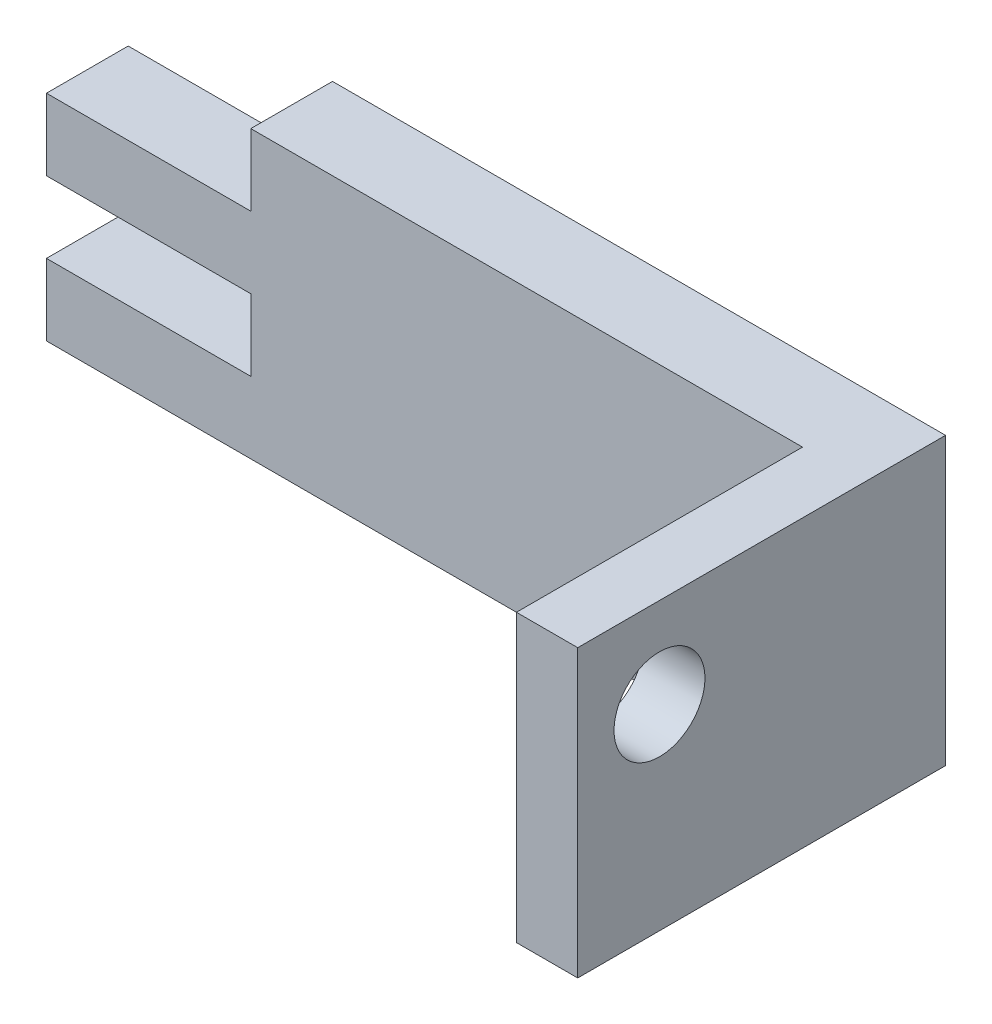
from build123d import *

# Parameters (mm, degrees)
CROQUIS1_W              = 350
CROQUIS1_H              = 90
SALIENTE_EXTRUIR1_DEPTH = 70
CROQUIS2_W              = 320
CROQUIS2_H              = 70
CORTAR_EXTRUIR1_DEPTH   = 194.778223751
CROQUIS3_R              = 11.125
CORTAR_EXTRUIR2_DEPTH   = 360.756862339
CROQUIS8_R              = 11.075
CORTAR_EXTRUIR3_DEPTH   = 209.865985742
CROQUIS9_R              = 11.075
CORTAR_EXTRUIR5_DEPTH   = 209.865985742


with BuildPart() as part:
    # Croquis1 → Saliente-Extruir1 (new body)
    with BuildSketch(Plane(origin=(0, 0, 0), x_dir=(1, 0, 0), z_dir=(0, 1, 0))):
        Rectangle(CROQUIS1_W, CROQUIS1_H)
    extrude(amount=SALIENTE_EXTRUIR1_DEPTH)

    # Croquis2 → Cortar-Extruir1 (cut, through all)
    with BuildSketch(Plane(origin=(0, 70, 0), x_dir=(1, 0, 0), z_dir=(0, 1, 0))):
        with Locations((0, -10)):
            Rectangle(CROQUIS2_W, CROQUIS2_H)
    extrude(amount=-CORTAR_EXTRUIR1_DEPTH, mode=Mode.SUBTRACT)

    # Croquis3 → Cortar-Extruir2 (cut, through all)
    with BuildSketch(Plane.ZY.offset(175)):
        with Locations((25, 48)):
            Circle(CROQUIS3_R)
    extrude(amount=-CORTAR_EXTRUIR2_DEPTH, mode=Mode.SUBTRACT)

    # Croquis8 → Cortar-Extruir3 (cut, through all)
    with BuildSketch(Plane(origin=(0, 0, -45), x_dir=(-1, 0, 0), z_dir=(0, 0, -1))):
        with Locations((-143.5, 21.5)):
            Circle(CROQUIS8_R)
    cortar_extruir3 = extrude(amount=-CORTAR_EXTRUIR3_DEPTH, mode=Mode.SUBTRACT)

    # Simetría1: Cortar-Extruir3 across plane
    add(cortar_extruir3.mirror(Plane(origin=(0, 0, 0), x_dir=(0, 0, 1), z_dir=(1, 0, 0))), mode=Mode.SUBTRACT)

    # Croquis9 → Cortar-Extruir5 (cut, through all)
    with BuildSketch(Plane(origin=(0, 0, -45), x_dir=(-1, 0, 0), z_dir=(0, 0, -1))):
        Polygon((-25, 35), (-25, 17.5), (25, 17.5), (25, 0), (175, 0), (175, 70), (-25, 70), (-25, 52.5), (25, 52.5), (25, 35), align=None)
        with Locations((143.5, 21.5)):
            Circle(CROQUIS9_R, mode=Mode.SUBTRACT)
    extrude(amount=-CORTAR_EXTRUIR5_DEPTH, mode=Mode.SUBTRACT)


solid = part.part
